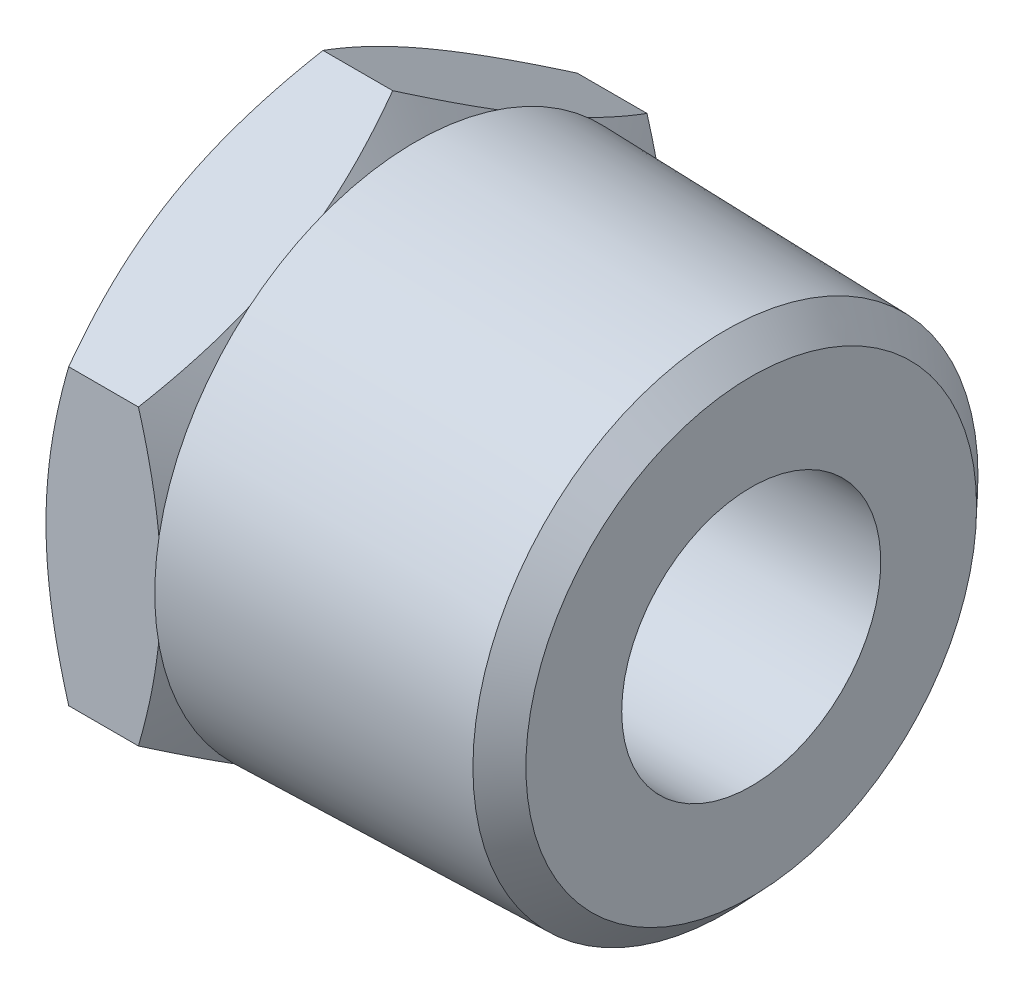
from build123d import *

# Parameters (mm, degrees)
SKETCH2_R          = 13.335
EXTRUDE1_DEPTH     = 17.78
EXTRUDE1_DRAFT     = 1.5
CHAMFER1_SIZE      = 1.366157143
CHAMFER1_SIZE2     = 1.403374095
EXTRUDE2_DEPTH     = 6.096
SKETCH6_R          = 6.858
CUT_EXTRUDE1_DEPTH = 28.353582774
CUT_EXTRUDE1_DRAFT = 1.5
SKETCH12_OUTSIDE_W = 152.316
SKETCH12_OUTSIDE_H = 155.804
SKETCH12_OUTSIDE_R = 13.462
CUT_EXTRUDE6_DEPTH = 32.656807587
CUT_EXTRUDE6_DRAFT = -60
SKETCH13_OUTSIDE_W = 137.41
SKETCH13_OUTSIDE_H = 140.898
SKETCH13_OUTSIDE_R = 13.462
CUT_EXTRUDE7_DEPTH = 28.353582774
CUT_EXTRUDE7_DRAFT = -60
SKETCH15_R         = 6.858
CUT_EXTRUDE8_DEPTH = 28.353582774


with BuildPart() as part:
    # Sketch2 → Extrude1 (with draft: the straight prism first)
    with BuildSketch(Plane(origin=(11.938, 0, 0), x_dir=(0, 0, -1), z_dir=(1, 0, 0))):
        Circle(SKETCH2_R)
    extrude(amount=-EXTRUDE1_DEPTH)
    # Extrude1: the draft: its side faces are tilted about the plane it starts from
    extrude1_sides = [part.faces().sort_by_distance(p)[0] for p in [
        (3.048, 0, 13.335),
    ]]
    draft(extrude1_sides, Plane(origin=(11.938, 0, 0), x_dir=(0, 0, -1), z_dir=(1, 0, 0)), EXTRUDE1_DRAFT)

    # Chamfer1
    chamfer1_edges = [part.edges().sort_by_distance(p)[0] for p in [
        (11.938, 0, 13.335),
    ]]
    chamfer1_side = [part.faces().sort_by_distance(p)[0] for p in [
        (3.048, 0, 13.567792843),
    ]]
    chamfer(chamfer1_edges, length=CHAMFER1_SIZE, length2=CHAMFER1_SIZE2, reference=chamfer1_side[0])

    # Sketch5 → Extrude2 (add)
    with BuildSketch(Plane.ZY.offset(5.842)):
        Polygon((0, 15.544578648), (-13.462, 7.772289324), (-13.462, -7.772289324), (0, -15.544578648), (13.462, -7.772289324), (13.462, 7.772289324), align=None)
    extrude(amount=EXTRUDE2_DEPTH)


with BuildPart() as cut_extrude1_tool:
    # Sketch6 → Cut-Extrude1 (with draft: the straight prism first)
    with BuildSketch(Plane(origin=(-5.842, 0, 0), x_dir=(0, 0, -1), z_dir=(1, 0, 0))):
        Circle(SKETCH6_R)
    extrude(amount=-CUT_EXTRUDE1_DEPTH)
    # Cut-Extrude1: the draft: its side faces are tilted about the plane it starts from
    cut_extrude1_sides = [cut_extrude1_tool.faces().sort_by_distance(p)[0] for p in [
        (-20.018791387, 0, 6.858),
    ]]
    draft(cut_extrude1_sides, Plane(origin=(-5.842, 0, 0), x_dir=(0, 0, -1), z_dir=(1, 0, 0)), CUT_EXTRUDE1_DRAFT)


with BuildPart() as part_1:
    add(part.part)

    # Cut-Extrude1: cut by cut_extrude1_tool
    add(cut_extrude1_tool.part, mode=Mode.SUBTRACT)

    # Cut-Extrude4 cone 1 section (through the dimple's axis) → Cut-Extrude4 (revolve, cut)
    with BuildSketch(Plane(origin=(-11.938, 0, 0), x_dir=(0, 0, 1), z_dir=(0, 1, 0))):
        Polygon((0, 0), (7.017629378, 0), (0, 7.017629378), align=None)
    revolve(axis=Axis((-11.938, 0, 0), (1, 0, 0)), mode=Mode.SUBTRACT)


with BuildPart() as cut_extrude6_tool:
    # Sketch12 outside → Cut-Extrude6 (with draft: the straight prism first)
    with BuildSketch(Plane.ZY.offset(11.938)):
        Rectangle(SKETCH12_OUTSIDE_W, SKETCH12_OUTSIDE_H)
        Circle(SKETCH12_OUTSIDE_R, mode=Mode.SUBTRACT)
    extrude(amount=-CUT_EXTRUDE6_DEPTH)
    # Cut-Extrude6: the draft: its side faces are tilted about the plane it starts from
    cut_extrude6_sides = [cut_extrude6_tool.faces().sort_by_distance(p)[0] for p in [
        (4.390403793, -77.902, 0),
        (4.390403793, 0, 76.158),
        (4.390403793, 77.902, 0),
        (4.390403793, 0, -76.158),
        (4.390403793, 0, -13.462),
    ]]
    draft(cut_extrude6_sides, Plane.ZY.offset(11.938), CUT_EXTRUDE6_DRAFT)


with BuildPart() as part_2:
    add(part_1.part)

    # Cut-Extrude6: cut by cut_extrude6_tool
    add(cut_extrude6_tool.part, mode=Mode.SUBTRACT)


with BuildPart() as cut_extrude7_tool:
    # Sketch13 outside → Cut-Extrude7 (with draft: the straight prism first)
    with BuildSketch(Plane(origin=(-5.842, 0, 0), x_dir=(0, 0, -1), z_dir=(1, 0, 0))):
        Rectangle(SKETCH13_OUTSIDE_W, SKETCH13_OUTSIDE_H)
        Circle(SKETCH13_OUTSIDE_R, mode=Mode.SUBTRACT)
    extrude(amount=-CUT_EXTRUDE7_DEPTH)
    # Cut-Extrude7: the draft: its side faces are tilted about the plane it starts from
    cut_extrude7_sides = [cut_extrude7_tool.faces().sort_by_distance(p)[0] for p in [
        (-20.018791387, -70.449, 0),
        (-20.018791387, 0, -68.705),
        (-20.018791387, 70.449, 0),
        (-20.018791387, 0, 68.705),
        (-20.018791387, 0, 13.462),
    ]]
    draft(cut_extrude7_sides, Plane(origin=(-5.842, 0, 0), x_dir=(0, 0, -1), z_dir=(1, 0, 0)), CUT_EXTRUDE7_DRAFT)


with BuildPart() as part_3:
    add(part_2.part)

    # Cut-Extrude7: cut by cut_extrude7_tool
    add(cut_extrude7_tool.part, mode=Mode.SUBTRACT)

    # Sketch15 → Cut-Extrude8 (cut, through all)
    with BuildSketch(Plane.ZY.offset(5.842)):
        Circle(SKETCH15_R)
    extrude(amount=-CUT_EXTRUDE8_DEPTH, mode=Mode.SUBTRACT)


solid = part_3.part
